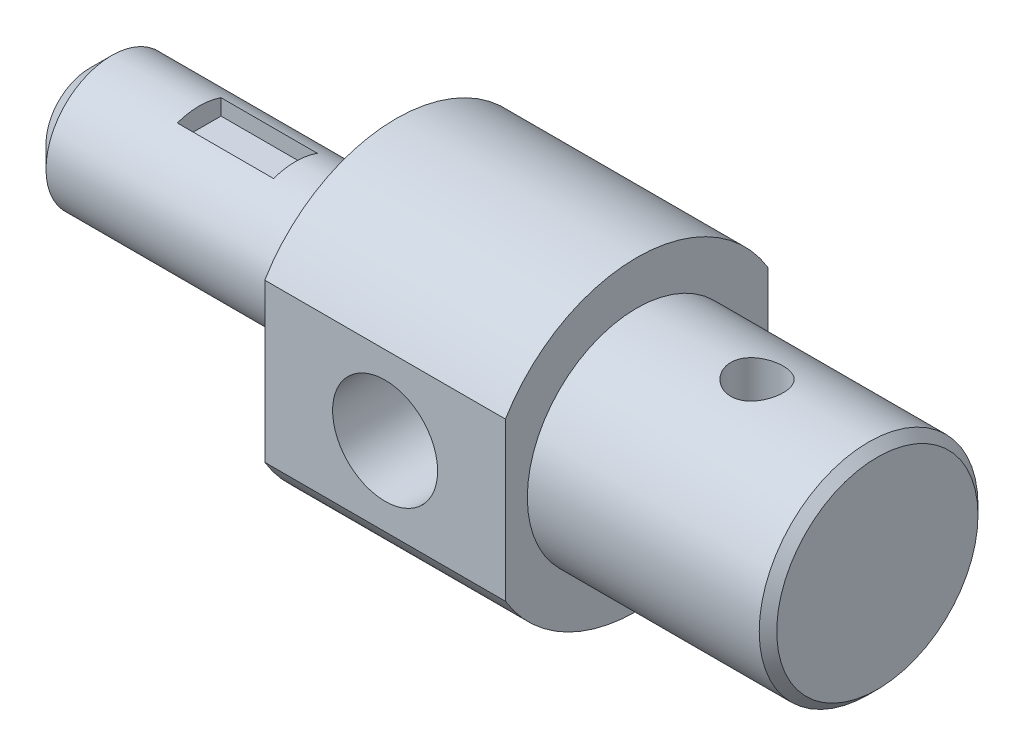
from build123d import *

# Parameters (mm, degrees)
CUT_EXTRUDE_1_DEPTH      = 135.443296597
SKETCH_3_W               = 22
SKETCH_3_H               = 4.5
CUT_EXTRUDE_2_DEPTH      = 5
HOLE_WIZARD_24_0_24_1_D  = 24
CUT_EXTRUDE_3_DEPTH      = 186.809041761
CUT_EXTRUDE_3_DEPTH_BACK = 186.809041761
SKETCH_8_R               = 6
CHAMFER_1_SIZE           = 2
CHAMFER_2_SIZE           = 5


with BuildPart() as part:
    # Эскиз1 → Повернуть1 (revolve)
    with BuildSketch(Plane.XY, mode=Mode.PRIVATE) as revolve_1_sk:
        Polygon((0, 0), (0, 15), (70, 15), (70, 35), (125, 35), (125, 25), (180, 25), (180, 0), align=None)
    revolve(revolve_1_sk.sketch.rotate(Axis((0, 0, 0), (-1, 0, 0)), 90), axis=Axis((0, 0, 0), (-1, 0, 0)))

    # Эскиз2 → Вырез-Вытянуть1 (cut, symmetric)
    with BuildSketch(Plane(origin=(125, 0, 0), x_dir=(0, 0, -1), z_dir=(1, 0, 0))):
        Polygon((-30, 195.8007333), (-30, 18.027756377), (-30, -18.027756377), (-30, -195.8007333), (-385.545953846, -195.8007333), (-385.545953846, 195.8007333), align=None)
    cut_extrude_1 = extrude(amount=CUT_EXTRUDE_1_DEPTH, both=True, mode=Mode.SUBTRACT)

    # Зеркальное отражение1: Вырез-Вытянуть1 across plane
    add(cut_extrude_1.mirror(Plane.XY), mode=Mode.SUBTRACT)

    # Эскиз3 → Вырез-Вытянуть2 (cut, symmetric)
    with BuildSketch(Plane.XY):
        with Locations((36, 12.75)):
            Rectangle(SKETCH_3_W, SKETCH_3_H)
    extrude(amount=CUT_EXTRUDE_2_DEPTH, both=True, mode=Mode.SUBTRACT)

    # Диаметр отверстия Ø24.0 (24)1 (through all)
    with Locations(Plane.XY.offset(30)):
        with Locations((97.5, 0)):
            Hole(HOLE_WIZARD_24_0_24_1_D / 2)

    # Эскиз8 → Вырез-Вытянуть3 (cut, two sides: drawn at the far end of the back side and taken through both)
    with BuildSketch(Plane(origin=(0, 0, 0), x_dir=(1, 0, 0), z_dir=(0, 1, 0)).offset(-CUT_EXTRUDE_3_DEPTH_BACK)):
        with Locations(Location((152.5, 0, 0), (0, 0, 270))):
            Circle(SKETCH_8_R)
    extrude(amount=CUT_EXTRUDE_3_DEPTH + CUT_EXTRUDE_3_DEPTH_BACK, mode=Mode.SUBTRACT)

    # Фаска1
    chamfer_1_edges = [part.edges().sort_by_distance(p)[0] for p in [
        (180, 0, 25),
    ]]
    chamfer(chamfer_1_edges, length=CHAMFER_1_SIZE)

    # Фаска2
    chamfer_2_edges = [part.edges().sort_by_distance(p)[0] for p in [
        (0, 0, 15),
    ]]
    chamfer(chamfer_2_edges, length=CHAMFER_2_SIZE)


solid = part.part
